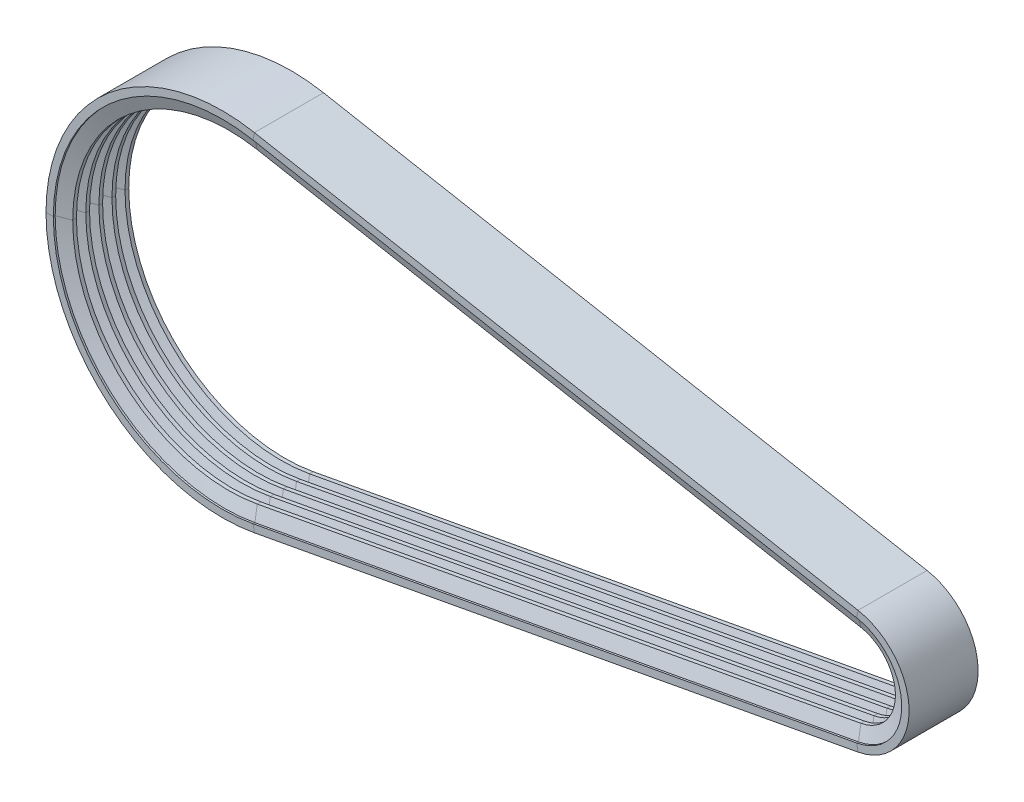
from build123d import *


with BuildPart() as part:
    # По траектории1: sweep along a path in Эскиз1
    with BuildLine(Plane.XY) as sweep_1_path:
        Line((-161.247058824, 47.195190653), (3.1, 16.714963356))
        ThreePointArc((3.1, 16.714963356), (17, 0), (3.1, -16.714963356))
        Line((3.1, -16.714963356), (-161.247058824, -47.195190653))
        ThreePointArc((-161.247058824, -47.195190653), (-218, 0), (-161.247058824, 47.195190653))
    # Эскиз2 → По траектории1 (sweep)
    with BuildSketch(Plane(origin=(0, 0, 0), x_dir=(1, 0, 0), z_dir=(0, 1, 0))):
        Polygon((-212.5, 3.05389582), (-216, 1.78), (-212.5, 0.50610418), (-212.5, -0.50610418), (-216, -1.78), (-212.5, -3.05389582), (-212.5, -4.06610418), (-216, -5.34), (-212.5, -6.61389582), (-212.5, -7.62610418), (-216, -8.9), (-216, -9.4), (-218, -9.4), (-218, 9.4), (-216, 9.4), (-216, 8.9), (-212.5, 7.62610418), (-212.5, 6.61389582), (-216, 5.34), (-212.5, 4.06610418), align=None)
    sweep(path=sweep_1_path.line)


solid = part.part
